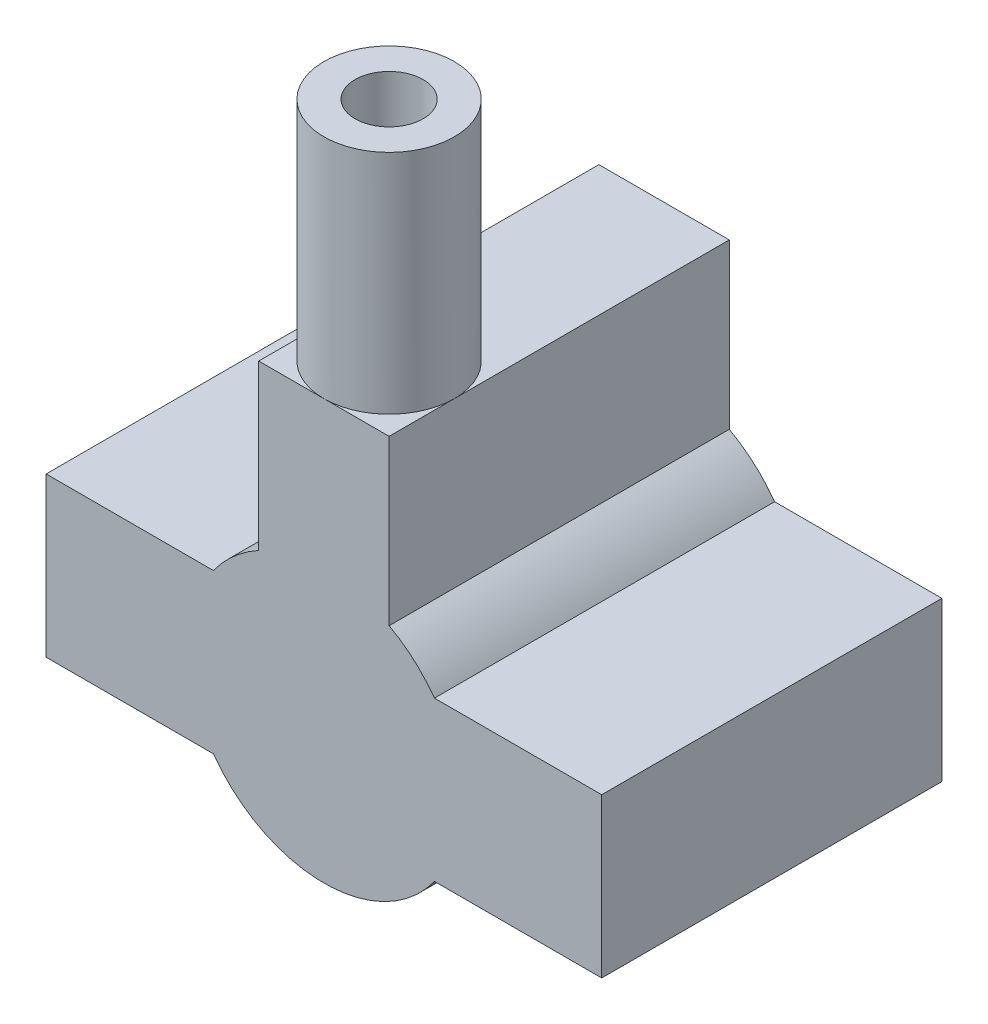
from build123d import *

# Parameters (mm, degrees)
BOSS_EXTRUDE1_DEPTH                = 6
BOSS_EXTRUDE2_DEPTH                = 4
M1_2X0_25_TAPPED_HOLE1_D           = 0.95
M1_2X0_25_TAPPED_HOLE1_DEPTH       = 3.15
M1_2X0_25_TAPPED_HOLE1_CBORE_D     = 1.2
M1_2X0_25_TAPPED_HOLE1_CBORE_DEPTH = 2.4
M1_2X0_25_TAPPED_HOLE1_TIP         = 0.285408794


with BuildPart() as part:
    # Sketch2 → Boss-Extrude1 (new body)
    with BuildSketch(Plane.XY):
        with BuildLine():
            Line((-131.1, -7.893462557), (-131.1, -5))
            Line((-131.1, -5), (-133.4, -5))
            Line((-133.4, -5), (-133.4, -7.893462557))
            ThreePointArc((-133.4, -7.893462557), (-133.839435478, -8.201752281), (-134.199358869, -8.6))
            Line((-134.199358869, -8.6), (-137.15, -8.6))
            Line((-137.15, -8.6), (-137.15, -11.4))
            Line((-137.15, -11.4), (-134.199358869, -11.4))
            ThreePointArc((-134.199358869, -11.4), (-132.25, -12.4), (-130.300641131, -11.4))
            Line((-130.300641131, -11.4), (-127.35, -11.4))
            Line((-127.35, -11.4), (-127.35, -8.6))
            Line((-127.35, -8.6), (-130.300641131, -8.6))
            ThreePointArc((-130.300641131, -8.6), (-130.660564522, -8.201752281), (-131.1, -7.893462557))
        make_face()
    extrude(amount=-BOSS_EXTRUDE1_DEPTH)

    # Sketch3 → Boss-Extrude2 (add)
    with BuildSketch(Plane(origin=(0, -5, 0), x_dir=(1, 0, 0), z_dir=(0, 1, 0))):
        with BuildLine():
            ThreePointArc((-133.4, 1.15), (-132.25, 0), (-131.1, 1.15))
            Line((-131.1, 1.15), (-133.4, 1.15))
        make_face()
        with BuildLine():
            Line((-133.4, 1.15), (-131.1, 1.15))
            ThreePointArc((-131.1, 1.15), (-132.25, 2.3), (-133.4, 1.15))
        make_face()
    extrude(amount=BOSS_EXTRUDE2_DEPTH)

    # M1.2x0.25 Tapped Hole1
    with Locations(Plane(origin=(-132.25, -1, -1.15), x_dir=(0, 0, 1), z_dir=(0, 1, 0))):
        with Locations((0, 0)):
            CounterBoreHole(M1_2X0_25_TAPPED_HOLE1_D / 2, M1_2X0_25_TAPPED_HOLE1_CBORE_D / 2, M1_2X0_25_TAPPED_HOLE1_CBORE_DEPTH, depth=M1_2X0_25_TAPPED_HOLE1_DEPTH)
            with Locations((0, 0, -(M1_2X0_25_TAPPED_HOLE1_DEPTH + M1_2X0_25_TAPPED_HOLE1_TIP / 2))):  # 118° drill point
                Cone(0, M1_2X0_25_TAPPED_HOLE1_D / 2, M1_2X0_25_TAPPED_HOLE1_TIP, mode=Mode.SUBTRACT)


solid = part.part
